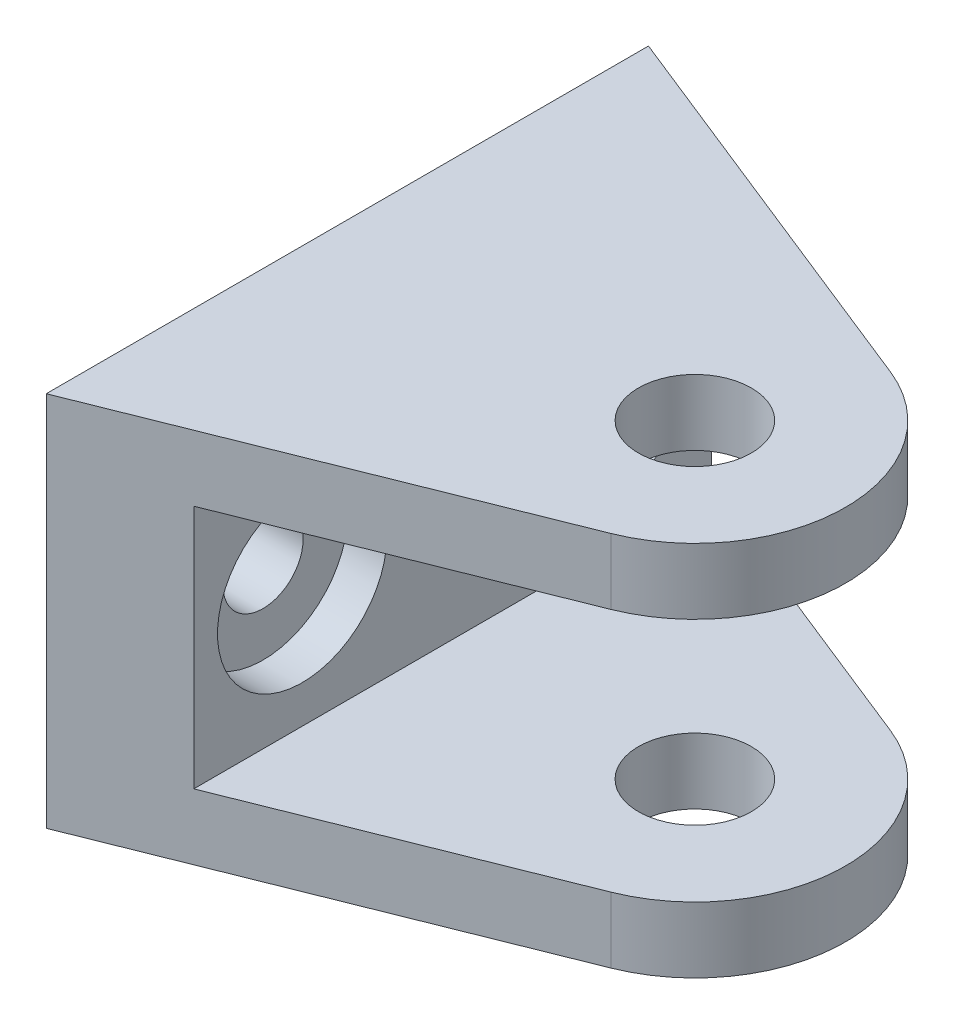
from build123d import *

# Parameters (mm, degrees)
BOSS_EXTRUDE1_DEPTH                                  = 50.8
CBORE_FOR_1_4_BINDING_HEAD_MACHINE_SCREW_D           = 6.7564
CBORE_FOR_1_4_BINDING_HEAD_MACHINE_SCREW_CBORE_D     = 14.2875
CBORE_FOR_1_4_BINDING_HEAD_MACHINE_SCREW_CBORE_DEPTH = 3.302
SPHERICAL_HOLES_REACH                                = 75.171
SKETCH3_R                                            = 4.7625
SKETCH4_OUTSIDE_W                                    = 58.65
SKETCH4_OUTSIDE_H                                    = 67.434
ROUNDING_DEPTH                                       = 31.75


with BuildPart() as part:
    # Sketch1 → Boss-Extrude1 (new body)
    with BuildSketch(Plane.XY):
        Polygon((0, 0), (42.015665571, 0), (42.015665571, 5.5499), (8.89, 5.5499), (8.89, 26.2001), (42.015665571, 26.2001), (42.015665571, 31.75), (0, 31.75), align=None)
    extrude(amount=BOSS_EXTRUDE1_DEPTH)

    # CBORE for 1/4 Binding Head Machine Screw1 (through all)
    with Locations(Plane(origin=(8.89, 0, 0), x_dir=(0, 0, -1), z_dir=(1, 0, 0))):
        with Locations((-38.1, 15.875), (-12.7, 15.875)):
            CounterBoreHole(CBORE_FOR_1_4_BINDING_HEAD_MACHINE_SCREW_D / 2, CBORE_FOR_1_4_BINDING_HEAD_MACHINE_SCREW_CBORE_D / 2, CBORE_FOR_1_4_BINDING_HEAD_MACHINE_SCREW_CBORE_DEPTH)

    # Spherical Holes: up to this face of the body (flat: up to its plane)
    spherical_holes_end = Plane(part.part.faces().sort_by_distance((21.007832786, 31.75, 25.4))[0])
    # Sketch3 → Spherical Holes (cut, up to the picked face)
    with BuildSketch(Plane.XZ, mode=Mode.PRIVATE) as spherical_holes_sk1:
        with Locations(Location((29.315665571, 25.4, 0), (0, 0, 270))):
            Circle(SKETCH3_R)
    spherical_holes_tool1 = split(extrude(spherical_holes_sk1.sketch, amount=-SPHERICAL_HOLES_REACH, mode=Mode.PRIVATE), bisect_by=spherical_holes_end, keep=Keep.BOTH, mode=Mode.PRIVATE)
    add(spherical_holes_tool1.solids().sort_by(Axis((29.315666, 0, 25.4), (0, 1, 0)))[0], mode=Mode.SUBTRACT)

    # Sketch4 outside → Rounding (cut)
    with BuildSketch(Plane(origin=(0, 31.75, 0), x_dir=(1, 0, 0), z_dir=(0, 1, 0))):
        with Locations((21.008, -25.4)):
            Rectangle(SKETCH4_OUTSIDE_W, SKETCH4_OUTSIDE_H)
        with BuildLine():
            Line((0, 0), (34.030957579, -13.607798285))
            ThreePointArc((34.030957579, -13.607798285), (42.015665571, -25.4), (34.030957579, -37.192201715))
            Line((34.030957579, -37.192201715), (0, -50.8))
            Line((0, -50.8), (0, 0))
        make_face(mode=Mode.SUBTRACT)
    extrude(amount=-ROUNDING_DEPTH, mode=Mode.SUBTRACT)


solid = part.part
